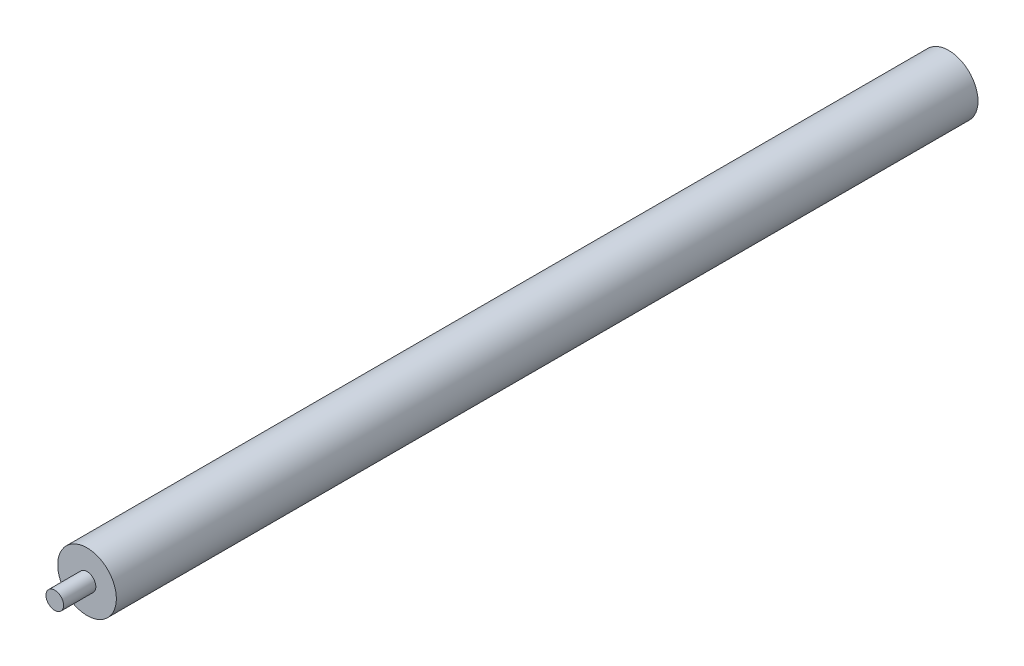
from build123d import *


with BuildPart() as part:
    # Sketch2 → Revolve1 (revolve)
    with BuildSketch(Plane(origin=(0, 0, 0), x_dir=(1, 0, 0), z_dir=(0, 1, 0))):
        Polygon((0, 0), (3, 0), (3, 11), (10, 11), (10, 304.8), (0, 304.8), align=None)
    revolve(axis=Axis((0, 0, 0), (0, 0, -1)))


solid = part.part
